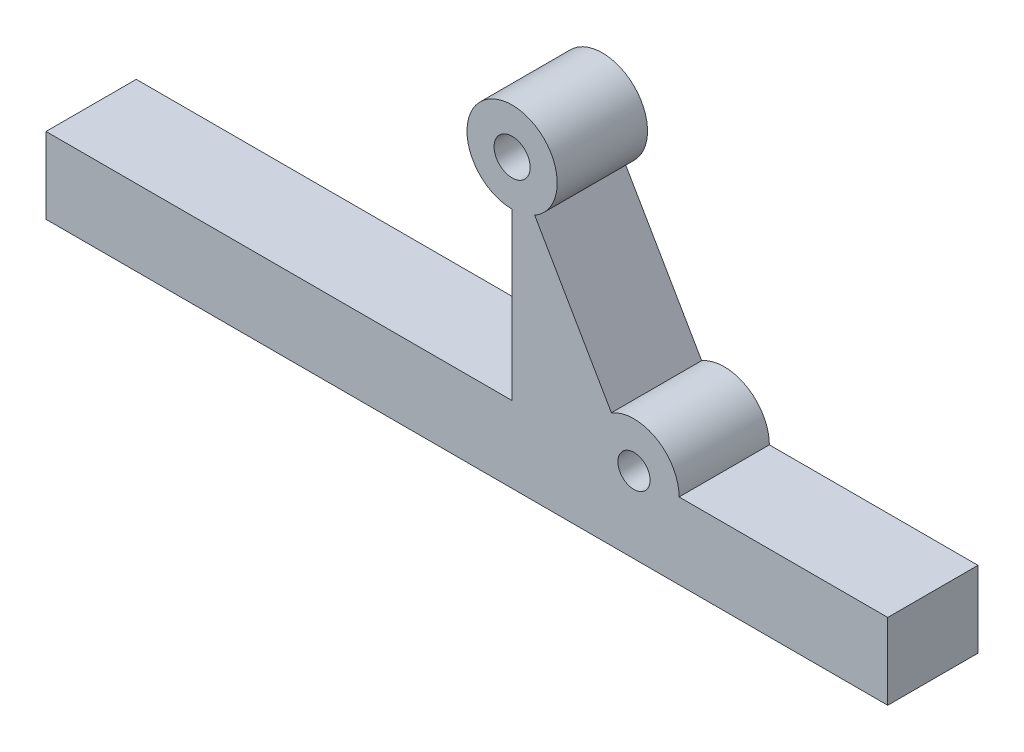
from build123d import *

# Parameters (mm, degrees)
SKETCH_2_R      = 2
EXTRUDE_1_DEPTH = 5


with BuildPart() as part:
    # 草图2 → 凸台-拉伸1 (new, symmetric)
    with BuildSketch(Plane.XY):
        with BuildLine():
            ThreePointArc((18.5, 0), (15.999089719, 4.330652442), (10.99817977, 4.329075598))
            Line((10.99817977, 4.329075598), (2.50182023, 19.030924402))
            ThreePointArc((2.50182023, 19.030924402), (-1.295110422, 28.189356996), (0, 18.36))
            Line((0, 18.36), (0, 0))
            Line((0, 0), (-51.636977369, 0))
            Line((-51.636977369, 0), (-51.636977369, -8.430841873))
            Line((-51.636977369, -8.430841873), (41.612216194, -8.430841873))
            Line((41.612216194, -8.430841873), (41.612216194, 0))
            Line((41.612216194, 0), (18.5, 0))
        make_face()
        with BuildLine():
            ThreePointArc((15.280750547, 0), (13.5, -1.780750547), (11.719249453, 0))
            ThreePointArc((11.719249453, 0), (13.5, 1.780750547), (15.280750547, 0))
        make_face(mode=Mode.SUBTRACT)
        with Locations((0, 23.36)):
            Circle(SKETCH_2_R, mode=Mode.SUBTRACT)
    extrude(amount=EXTRUDE_1_DEPTH, both=True)


solid = part.part
